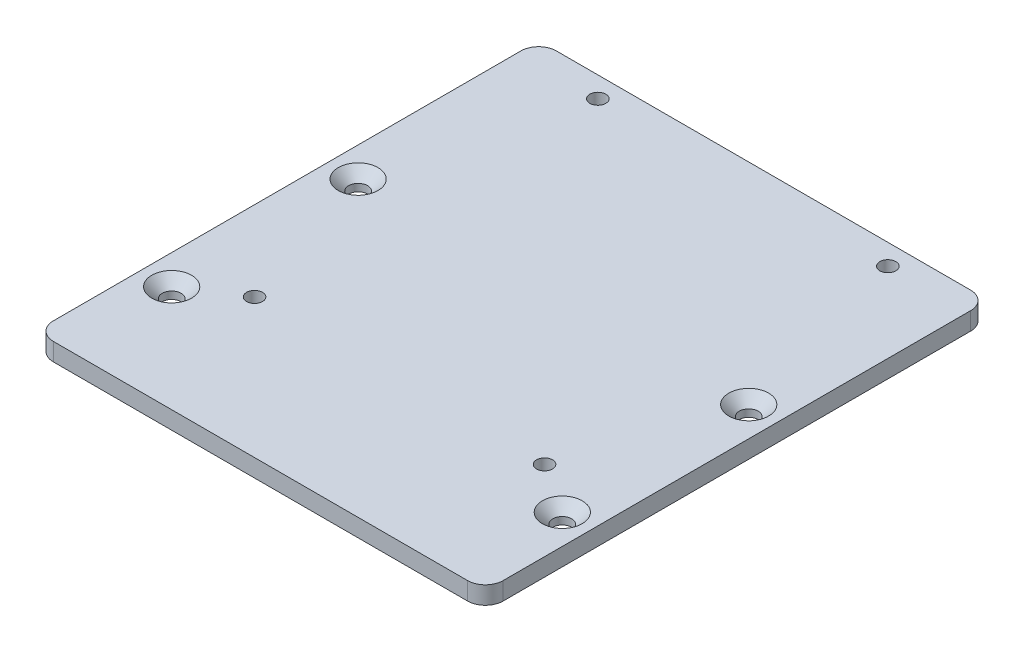
from build123d import *

# Parameters (mm, degrees)
SKETCH1_W                    = 76
SKETCH1_H                    = 85
BOSS_EXTRUDE1_DEPTH          = 3
M2_5_CLEARANCE_HOLE1_D       = 2.7
CSK_FOR_M3_SFHCS1_AT_2_COUNT = 2
CSK_FOR_M3_SFHCS1_AT_2_PITCH = 31.5
CSK_FOR_M3_SFHCS1_AT_3_COUNT = 2
CSK_FOR_M3_SFHCS1_AT_3_PITCH = 73.131730459
CSK_FOR_M3_SFHCS1_AT_4_COUNT = 2
CSK_FOR_M3_SFHCS1_AT_4_PITCH = 66
FILLET1_R                    = 3


with BuildPart() as part:
    # Sketch1 → Boss-Extrude1 (new body)
    with BuildSketch(Plane(origin=(0, 0, 0), x_dir=(1, 0, 0), z_dir=(0, 1, 0))):
        Rectangle(SKETCH1_W, SKETCH1_H)
    extrude(amount=BOSS_EXTRUDE1_DEPTH)

    # M2.5 Clearance Hole1 (through all)
    with Locations(Plane(origin=(0, 3, 0), x_dir=(1, 0, 0), z_dir=(0, 1, 0))):
        with Locations((-24.5, 39), (-24.5, -19), (24.5, -19), (24.5, 39)):
            Hole(M2_5_CLEARANCE_HOLE1_D / 2)

    # Sketch5 → CSK for M3 SFHCS1 (revolve, cut)
    with BuildSketch(Plane(origin=(-33, 3, 24.5), x_dir=(0, 0, 1), z_dir=(1, 0, 0))):
        Polygon((0, 0), (0, 3), (1.6, 3), (1.6, 1.76), (3.36, 0), align=None)
    csk_for_m3_sfhcs1 = revolve(axis=Axis((-33, 9.35, 24.5), (0, -1, 0)), mode=Mode.SUBTRACT)

    # CSK for M3 SFHCS1 at 2: CSK for M3 SFHCS1 ×2
    with Locations(*[(0, 0, -i * CSK_FOR_M3_SFHCS1_AT_2_PITCH) for i in range(1, CSK_FOR_M3_SFHCS1_AT_2_COUNT)]):
        add(csk_for_m3_sfhcs1, mode=Mode.SUBTRACT)

    # CSK for M3 SFHCS1 at 3: CSK for M3 SFHCS1 ×2
    with Locations(*[Vector(0.9024810377836799, 0, -0.43072958621493834) * (i * CSK_FOR_M3_SFHCS1_AT_3_PITCH) for i in range(1, CSK_FOR_M3_SFHCS1_AT_3_COUNT)]):
        add(csk_for_m3_sfhcs1, mode=Mode.SUBTRACT)

    # CSK for M3 SFHCS1 at 4: CSK for M3 SFHCS1 ×2
    with Locations(*[(i * CSK_FOR_M3_SFHCS1_AT_4_PITCH, 0, 0) for i in range(1, CSK_FOR_M3_SFHCS1_AT_4_COUNT)]):
        add(csk_for_m3_sfhcs1, mode=Mode.SUBTRACT)

    # Fillet1
    fillet1_edges = [part.edges().sort_by_distance(p)[0] for p in [
        (-38, 1.5, -42.5),
        (38, 1.5, -42.5),
        (38, 1.5, 42.5),
        (-38, 1.5, 42.5),
    ]]
    fillet(fillet1_edges, radius=FILLET1_R)


solid = part.part
